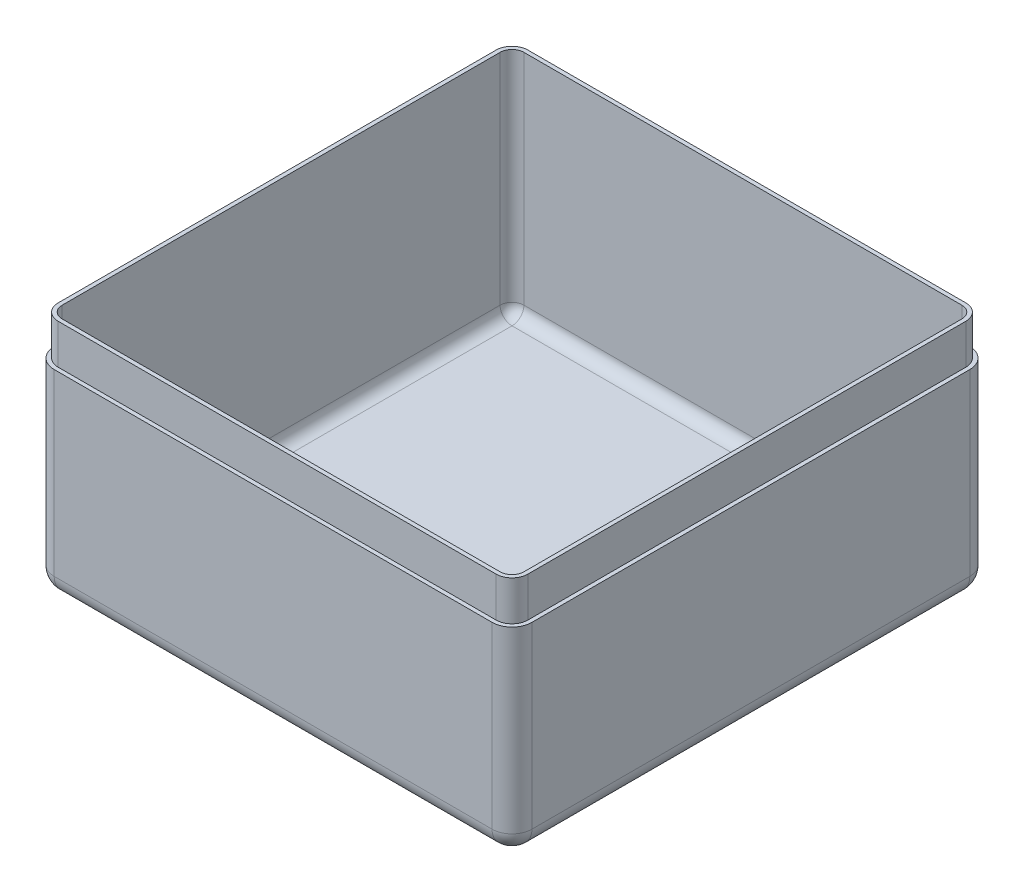
from build123d import *

# Parameters (mm, degrees)
SKETCH1_W           = 60
SKETCH1_H           = 60
BOSS_EXTRUDE1_DEPTH = 25
FILLET1_R           = 2.5
SHELL1_T            = -1
BOSS_EXTRUDE2_START = 5
BOSS_EXTRUDE2_DEPTH = 5


with BuildPart() as part:
    # Sketch1 → Boss-Extrude1 (new body)
    with BuildSketch(Plane(origin=(0, 0, 0), x_dir=(1, 0, 0), z_dir=(0, 1, 0))):
        with Locations((30, 30)):
            Rectangle(SKETCH1_W, SKETCH1_H)
    extrude(amount=BOSS_EXTRUDE1_DEPTH)

    # Fillet1
    fillet1_edges = [part.edges().sort_by_distance(p)[0] for p in [
        (30, 0, -60),
        (60, 0, -30),
        (30, 0, 0),
        (0, 0, -30),
        (0, 12.5, -60),
        (60, 12.5, -60),
        (60, 12.5, 0),
        (0, 12.5, 0),
    ]]
    fillet(fillet1_edges, radius=FILLET1_R)

    # Shell1
    shell1_openings = [part.faces().sort_by_distance(p)[0] for p in [
        (30, 25, -30),
    ]]
    offset(amount=SHELL1_T, openings=shell1_openings, kind=Kind.INTERSECTION)

    # Sketch5 → Boss-Extrude2 (add)
    with BuildSketch(Plane(origin=(0, 25, 0), x_dir=(1, 0, 0), z_dir=(0, 1, 0)).offset(BOSS_EXTRUDE2_START)):
        with BuildLine():
            Line((57.5, 59.5), (2.5, 59.5))
            ThreePointArc((2.5, 59.5), (1.085786438, 58.914213562), (0.5, 57.5))
            Line((0.5, 57.5), (0.5, 2.5))
            ThreePointArc((0.5, 2.5), (1.085786438, 1.085786438), (2.5, 0.5))
            Line((2.5, 0.5), (57.5, 0.5))
            ThreePointArc((57.5, 0.5), (58.914213562, 1.085786438), (59.5, 2.5))
            Line((59.5, 2.5), (59.5, 57.5))
            ThreePointArc((59.5, 57.5), (58.914213562, 58.914213562), (57.5, 59.5))
        make_face()
        with BuildLine():
            Line((57.5, 59), (2.5, 59))
            ThreePointArc((2.5, 59), (1.439339828, 58.560660172), (1, 57.5))
            Line((1, 57.5), (1, 2.5))
            ThreePointArc((1, 2.5), (1.439339828, 1.439339828), (2.5, 1))
            Line((2.5, 1), (57.5, 1))
            ThreePointArc((57.5, 1), (58.560660172, 1.439339828), (59, 2.5))
            Line((59, 2.5), (59, 57.5))
            ThreePointArc((59, 57.5), (58.560660172, 58.560660172), (57.5, 59))
        make_face(mode=Mode.SUBTRACT)
    extrude(amount=-BOSS_EXTRUDE2_DEPTH)


solid = part.part
